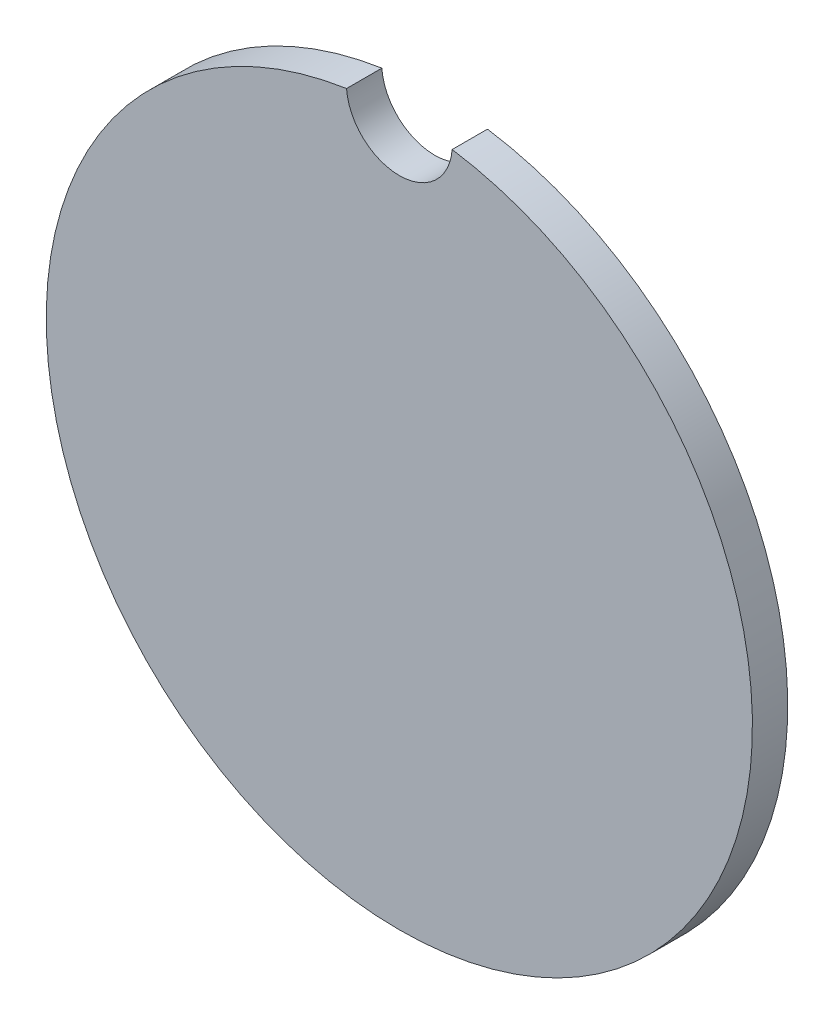
from build123d import *

# Parameters (mm, degrees)
BOSS_EXTRUDE1_DEPTH = 0.5


with BuildPart() as part:
    # Sketch1 → Boss-Extrude1 (new body)
    with BuildSketch(Plane.XY):
        with BuildLine():
            ThreePointArc((-0.74788765, 4.94375), (0, -5), (0.74788765, 4.94375))
            ThreePointArc((0.74788765, 4.94375), (0, 4.25), (-0.74788765, 4.94375))
        make_face()
    extrude(amount=BOSS_EXTRUDE1_DEPTH)


solid = part.part
